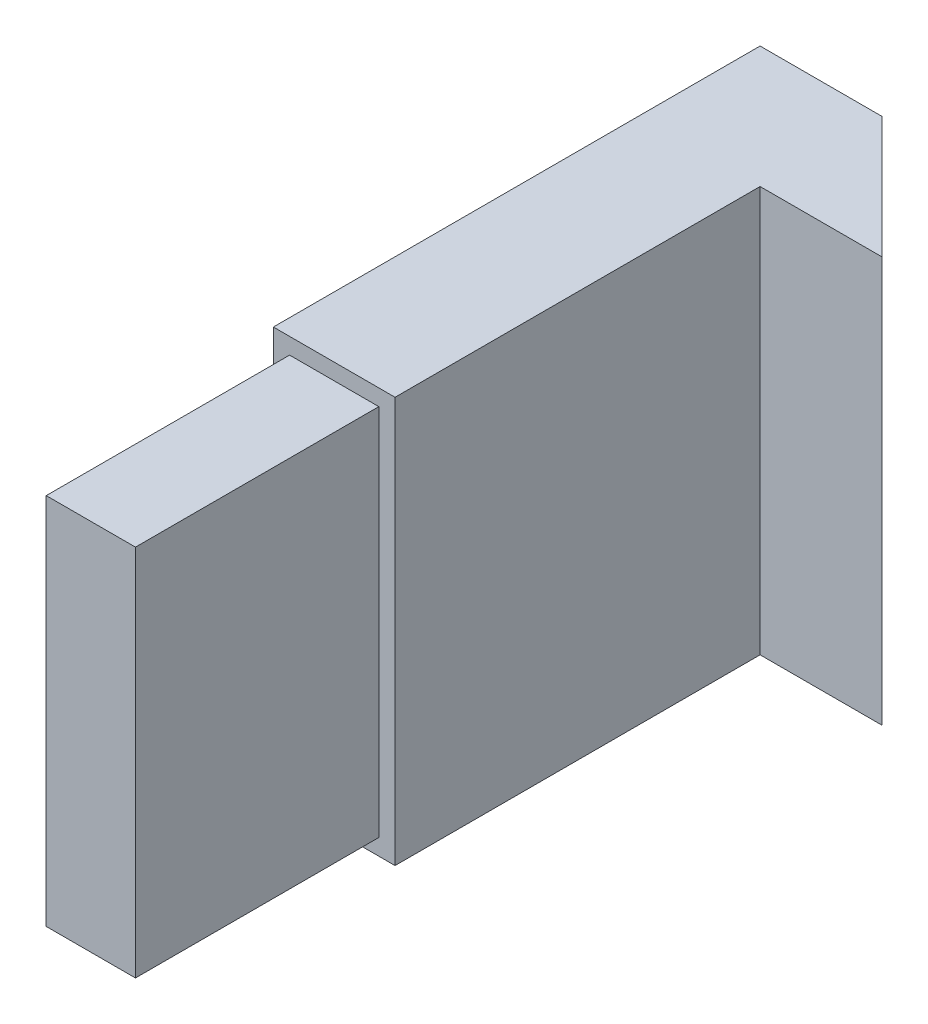
from build123d import *

# Parameters (mm, degrees)
BOSS_EXTRUDE1_DEPTH = 5
SKETCH2_W           = 1.1
SKETCH2_H           = 4.6
BOSS_EXTRUDE2_DEPTH = 3


with BuildPart() as part:
    # Sketch1 → Boss-Extrude1 (new body)
    with BuildSketch(Plane(origin=(0, 0, 0), x_dir=(1, 0, 0), z_dir=(0, 1, 0))):
        Polygon((0.75, 1.5), (2.25, 1.5), (0.75, 3), (-0.75, 3), (-0.75, -3), (-0.7, -3), (0.7, -3), (0.75, -3), align=None)
    extrude(amount=BOSS_EXTRUDE1_DEPTH)

    # Sketch2 → Boss-Extrude2 (add)
    with BuildSketch(Plane.XY.offset(3)):
        with Locations((0, 2.5)):
            Rectangle(SKETCH2_W, SKETCH2_H)
    extrude(amount=BOSS_EXTRUDE2_DEPTH)


solid = part.part
